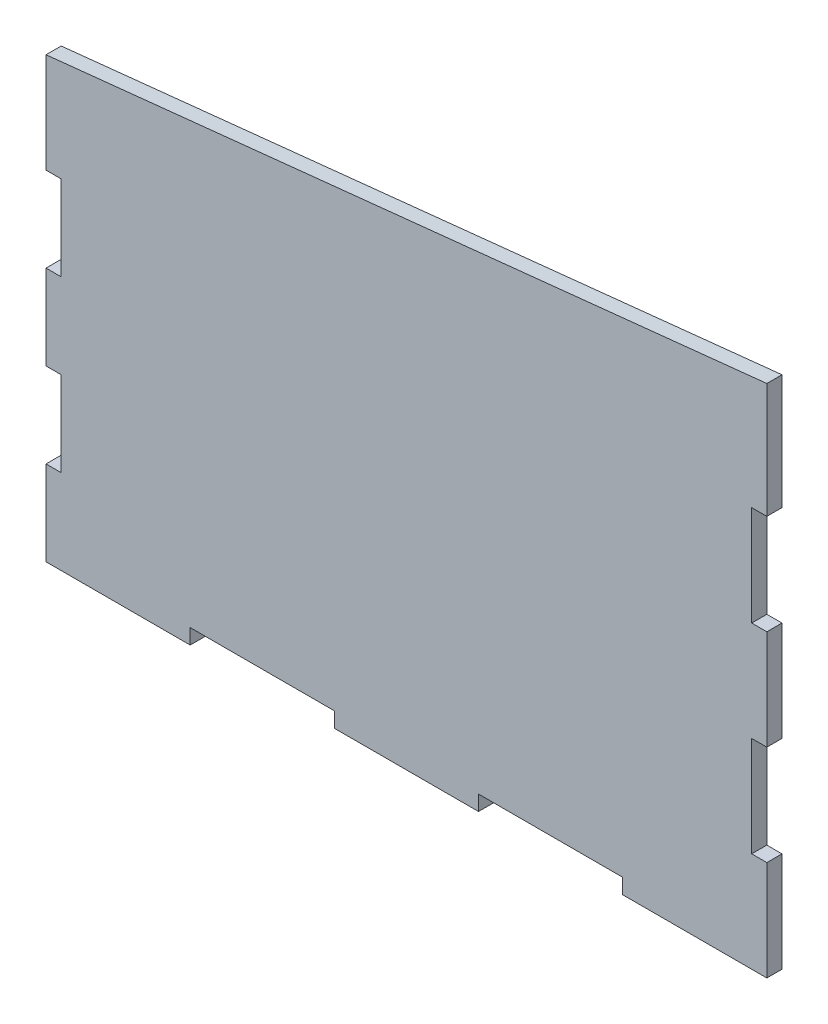
from build123d import *

# Parameters (mm, degrees)
BOSS_EXTRU_1_DEPTH      = 5
ESQUISSE2_W             = 5
ESQUISSE2_H             = 28
ESQUISSE2_W_2           = 47.6
ESQUISSE2_H_2           = 5
ESQUISSE2_H_3           = 33
ENL_V_MAT_EXTRU_1_DEPTH = 5


with BuildPart() as part:
    # Esquisse1 → Boss.-Extru.1 (new body)
    with BuildSketch(Plane.XY):
        Polygon((0, 0), (0, 145), (238, 170), (238, 5), (238, 0), align=None)
    extrude(amount=BOSS_EXTRU_1_DEPTH)

    # Esquisse2 → Enlèv. mat.-Extru.1 (cut)
    with BuildSketch(Plane.XY.offset(5)):
        with Locations((2.5, 42)):
            Rectangle(ESQUISSE2_W, ESQUISSE2_H)
        with Locations((2.5, 98)):
            Rectangle(ESQUISSE2_W, ESQUISSE2_H)
        with Locations((71.4, 2.5)):
            Rectangle(ESQUISSE2_W_2, ESQUISSE2_H_2)
        with Locations((166.6, 2.5)):
            Rectangle(ESQUISSE2_W_2, ESQUISSE2_H_2)
        with Locations((235.5, 115.5)):
            Rectangle(ESQUISSE2_W, ESQUISSE2_H_3)
        with Locations((235.5, 49.5)):
            Rectangle(ESQUISSE2_W, ESQUISSE2_H_3)
    extrude(amount=-ENL_V_MAT_EXTRU_1_DEPTH, mode=Mode.SUBTRACT)


solid = part.part
